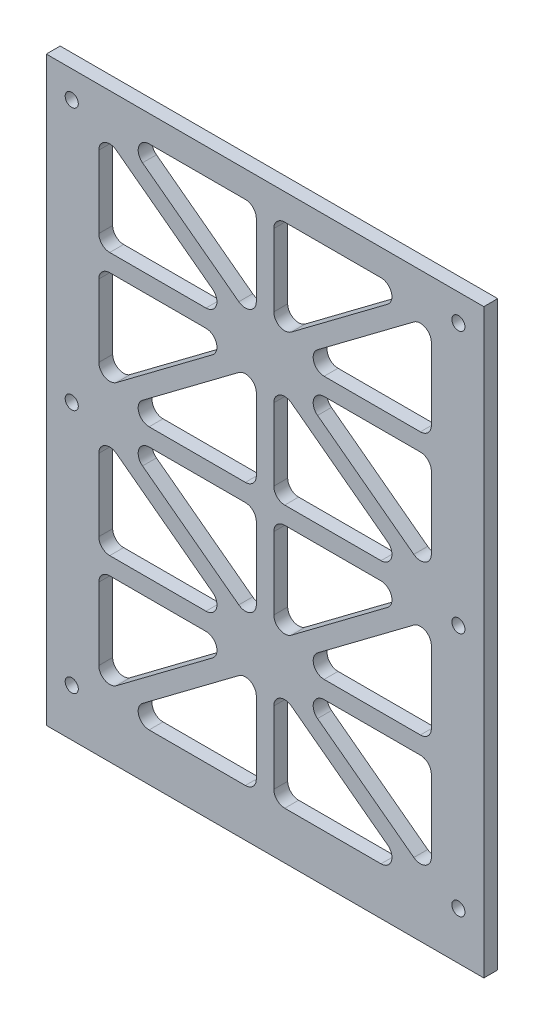
from build123d import *

# Parameters (mm, degrees)
SKETCH1_W                   = 100
SKETCH1_H                   = 265.76692074
SKETCH1_R                   = 3
BOSS_EXTRUDE2_DEPTH         = 6.35
CUTOUT_FILLETS_R            = 5
CUTOUT_FILLETS_OF_MIRROR2_R = 5


with BuildPart() as part:
    # Sketch1 → Boss-Extrude2 (new body)
    with BuildSketch(Plane.XY):
        with Locations((50, -1.035589772)):
            Rectangle(SKETCH1_W, SKETCH1_H)
        with Locations((88.366051518, 119.531107423)):
            Circle(SKETCH1_R, mode=Mode.SUBTRACT)
        with Locations((88.366051518, -0.213108197)):
            Circle(SKETCH1_R, mode=Mode.SUBTRACT)
        with Locations((88.366051518, -112.213108197)):
            Circle(SKETCH1_R, mode=Mode.SUBTRACT)
        Polygon((4, 119.786891803), (4, 71.786891803), (68, 119.786891803), align=None, mode=Mode.SUBTRACT)
        Polygon((76, 115.786891803), (12, 67.786891803), (76, 67.786891803), align=None, mode=Mode.SUBTRACT)
        Polygon((12, 59.786891803), (76, 59.786891803), (76, 11.786891803), align=None, mode=Mode.SUBTRACT)
        Polygon((68, 7.786891803), (4, 55.786891803), (4, 7.786891803), align=None, mode=Mode.SUBTRACT)
        Polygon((4, -0.213108197), (68, -0.213108197), (4, -48.213108197), align=None, mode=Mode.SUBTRACT)
        Polygon((76, -4.213108197), (12, -52.213108197), (76, -52.213108197), align=None, mode=Mode.SUBTRACT)
        Polygon((12, -60.213108197), (76, -60.213108197), (76, -108.213108197), align=None, mode=Mode.SUBTRACT)
        Polygon((4, -112.213108197), (4, -64.213108197), (68, -112.213108197), align=None, mode=Mode.SUBTRACT)
    boss_extrude2 = extrude(amount=BOSS_EXTRUDE2_DEPTH)

    # Cutout_Fillets
    cutout_fillets_edges = [part.edges().sort_by_distance(p)[0] for p in [
        (68, 119.786891803, 3.175),
        (4, 119.786891803, 3.175),
        (4, 71.786891803, 3.175),
        (76, 67.786891803, 3.175),
        (76, 115.786891803, 3.175),
        (12, 67.786891803, 3.175),
        (12, 59.786891803, 3.175),
        (76, 11.786891803, 3.175),
        (76, 59.786891803, 3.175),
        (4, 7.786891803, 3.175),
        (68, 7.786891803, 3.175),
        (4, 55.786891803, 3.175),
        (4, -0.213108197, 3.175),
        (4, -48.213108197, 3.175),
        (68, -0.213108197, 3.175),
        (76, -52.213108197, 3.175),
        (76, -4.213108197, 3.175),
        (12, -52.213108197, 3.175),
        (12, -60.213108197, 3.175),
        (76, -108.213108197, 3.175),
        (76, -60.213108197, 3.175),
        (4, -112.213108197, 3.175),
        (68, -112.213108197, 3.175),
        (4, -64.213108197, 3.175),
    ]]
    fillet(cutout_fillets_edges, radius=CUTOUT_FILLETS_R)

    # Mirror2: Boss-Extrude2 across plane
    add(boss_extrude2.mirror(Plane(origin=(0, 131.847870598, 6.35), x_dir=(0, 0, 1), z_dir=(1, 0, 0))))

    # Cutout_Fillets of Mirror2
    cutout_fillets_of_mirror2_edges = [part.edges().sort_by_distance(p)[0] for p in [
        (-68, 119.786891803, 3.175),
        (-4, 119.786891803, 3.175),
        (-4, 71.786891803, 3.175),
        (-76, 67.786891803, 3.175),
        (-76, 115.786891803, 3.175),
        (-12, 67.786891803, 3.175),
        (-12, 59.786891803, 3.175),
        (-76, 11.786891803, 3.175),
        (-76, 59.786891803, 3.175),
        (-4, 7.786891803, 3.175),
        (-68, 7.786891803, 3.175),
        (-4, 55.786891803, 3.175),
        (-4, -0.213108197, 3.175),
        (-4, -48.213108197, 3.175),
        (-68, -0.213108197, 3.175),
        (-76, -52.213108197, 3.175),
        (-76, -4.213108197, 3.175),
        (-12, -52.213108197, 3.175),
        (-12, -60.213108197, 3.175),
        (-76, -108.213108197, 3.175),
        (-76, -60.213108197, 3.175),
        (-4, -112.213108197, 3.175),
        (-68, -112.213108197, 3.175),
        (-4, -64.213108197, 3.175),
    ]]
    fillet(cutout_fillets_of_mirror2_edges, radius=CUTOUT_FILLETS_OF_MIRROR2_R)


solid = part.part
